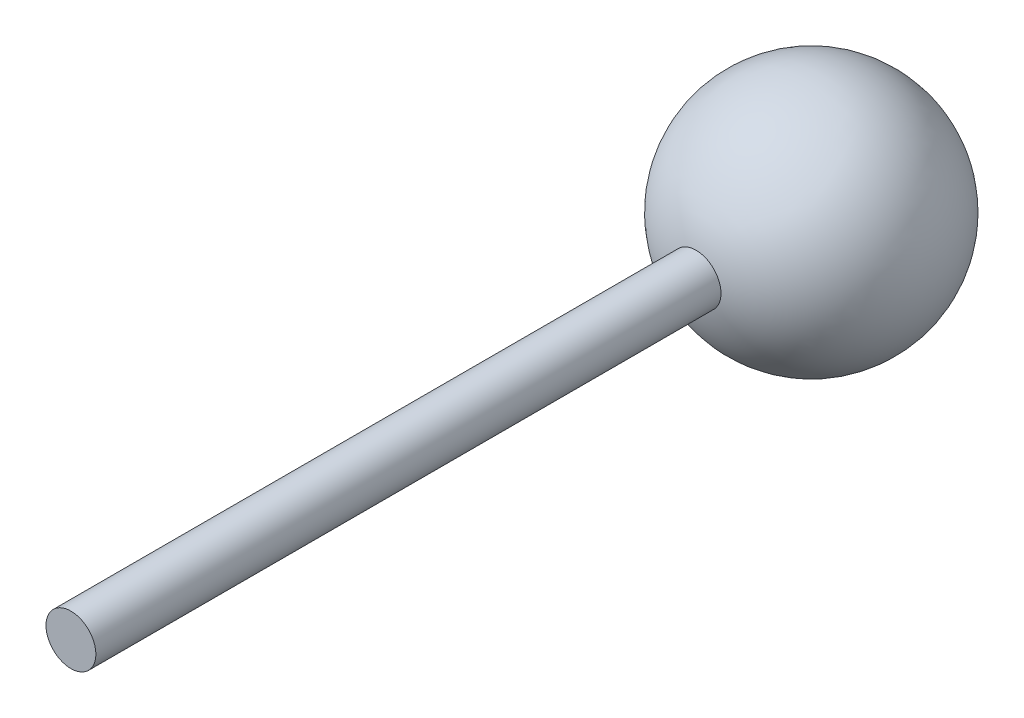
from build123d import *


with BuildPart() as part:
    # Sketch2 → Revolve2 (revolve)
    with BuildSketch(Plane(origin=(0, 0, 0), x_dir=(1, 0, 0), z_dir=(0, 1, 0)), mode=Mode.PRIVATE) as revolve2_sk:
        with BuildLine():
            Line((0, 28.377137052), (0, -28.179120792))
            Line((0, -28.179120792), (0, -178.179120792))
            Line((0, -178.179120792), (-6, -178.179120792))
            Line((-6, -178.179120792), (-6, -27.735571154))
            ThreePointArc((-6, -27.735571154), (-28.21628972, 3.01710154), (0, 28.377137052))
        make_face()
    revolve(revolve2_sk.sketch.rotate(Axis((0, 0, -28.377137052), (0, 0, 1)), 180), axis=Axis((0, 0, -28.377137052), (0, 0, 1)))


solid = part.part
